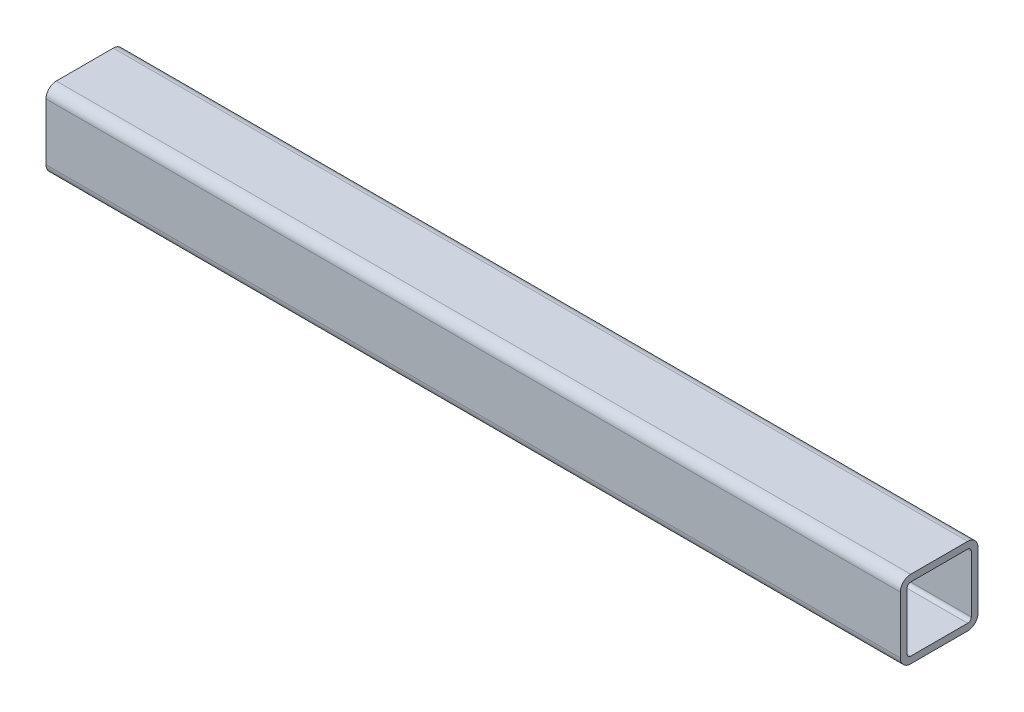
from build123d import *

# Parameters (mm, degrees)
BOSS_EXTRUDE1_DEPTH = 209.55


with BuildPart() as part:
    # Sketch1 → Boss-Extrude1 (new body)
    with BuildSketch(Plane(origin=(0, 0, 0), x_dir=(0, 0, -1), z_dir=(1, 0, 0))):
        with BuildLine():
            Line((0, 2.54), (0, 16.51))
            ThreePointArc((0, 16.51), (-0.743948776, 18.306051224), (-2.54, 19.05))
            Line((-2.54, 19.05), (-16.51, 19.05))
            ThreePointArc((-16.51, 19.05), (-18.306051224, 18.306051224), (-19.05, 16.51))
            Line((-19.05, 16.51), (-19.05, 2.54))
            ThreePointArc((-19.05, 2.54), (-18.306051224, 0.743948776), (-16.51, 0))
            Line((-16.51, 0), (-2.54, 0))
            ThreePointArc((-2.54, 0), (-0.743948776, 0.743948776), (0, 2.54))
        make_face()
        with BuildLine():
            Line((-1.651, 2.54), (-1.651, 16.51))
            ThreePointArc((-1.651, 16.51), (-1.911382072, 17.138617928), (-2.54, 17.399))
            Line((-2.54, 17.399), (-16.51, 17.399))
            ThreePointArc((-16.51, 17.399), (-17.138617928, 17.138617928), (-17.399, 16.51))
            Line((-17.399, 16.51), (-17.399, 2.54))
            ThreePointArc((-17.399, 2.54), (-17.138617928, 1.911382072), (-16.51, 1.651))
            Line((-16.51, 1.651), (-2.54, 1.651))
            ThreePointArc((-2.54, 1.651), (-1.911382072, 1.911382072), (-1.651, 2.54))
        make_face(mode=Mode.SUBTRACT)
    extrude(amount=BOSS_EXTRUDE1_DEPTH)


solid = part.part
